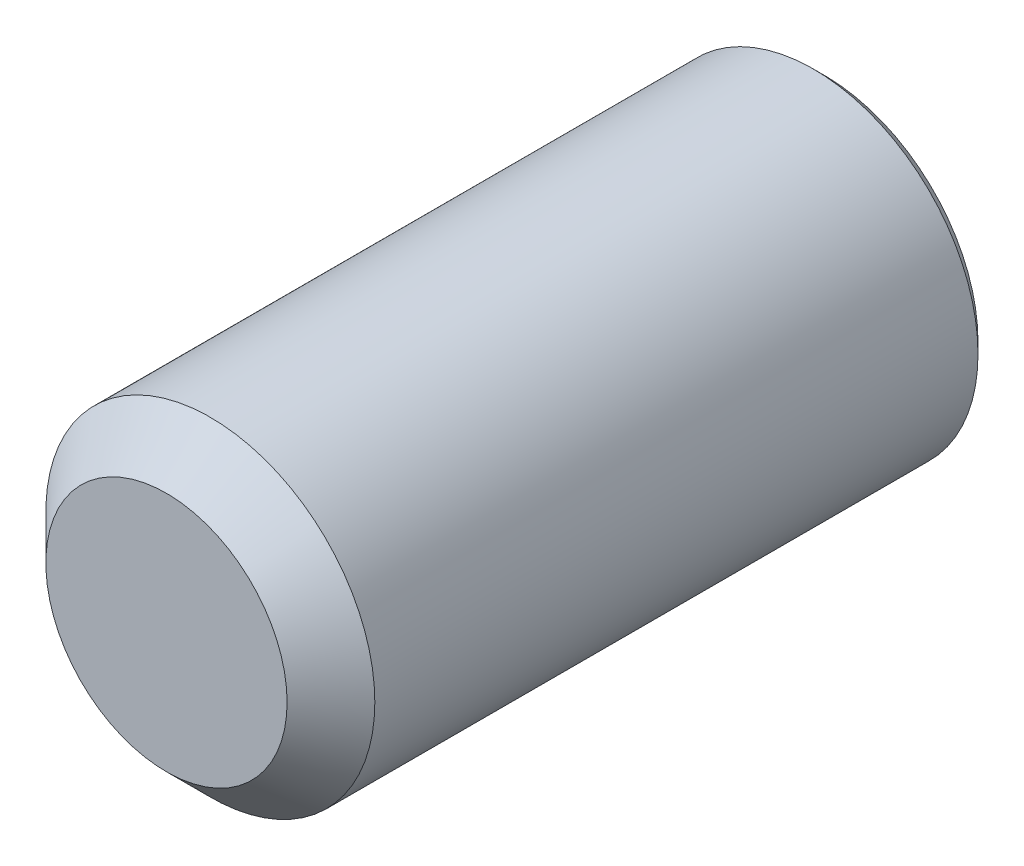
from build123d import *

# Parameters (mm, degrees)
SKETCH_1_R          = 1.5
EXTRUDE_1_DEPTH     = 6
CHAMFER_1_SIZE      = 0.4
CUT_EXTRUDE_1_DEPTH = 1.2
CHAMFER_2_SIZE      = 0.1


with BuildPart() as part:
    # 草图1 → 凸台-拉伸1 (new body)
    with BuildSketch(Plane.XY):
        Circle(SKETCH_1_R)
    extrude(amount=EXTRUDE_1_DEPTH)

    # 倒角1
    chamfer_1_edges = [part.edges().sort_by_distance(p)[0] for p in [
        (-1.5, 0, 6),
    ]]
    chamfer(chamfer_1_edges, length=CHAMFER_1_SIZE)

    # 草图2 → 切除-拉伸1 (cut)
    with BuildSketch(Plane(origin=(0, 0, 0), x_dir=(-1, 0, 0), z_dir=(0, 0, -1))):
        Polygon((0.498286364, 0.708315396), (-0.364275945, 0.785686347), (-0.862562308, 0.077370951), (-0.498286364, -0.708315396), (0.364275945, -0.785686347), (0.862562308, -0.077370951), align=None)
    extrude(amount=-CUT_EXTRUDE_1_DEPTH, mode=Mode.SUBTRACT)

    # 倒角2
    chamfer_2_edges = [part.edges().sort_by_distance(p)[0] for p in [
        (-0.680424336, 0.315472222, 1.2),
        (-0.613419127, -0.431528649, 1.2),
        (0.067005209, -0.747000871, 1.2),
        (0.680424336, -0.315472222, 1.2),
        (0.613419127, 0.431528649, 1.2),
        (-0.067005209, 0.747000871, 1.2),
        (-0.680424336, 0.315472222, 0),
        (-0.067005209, 0.747000871, 0),
        (0.613419127, 0.431528649, 0),
        (0.680424336, -0.315472222, 0),
        (0.067005209, -0.747000871, 0),
        (-0.613419127, -0.431528649, 0),
        (-1.5, 0, 0),
    ]]
    chamfer(chamfer_2_edges, length=CHAMFER_2_SIZE)


solid = part.part
